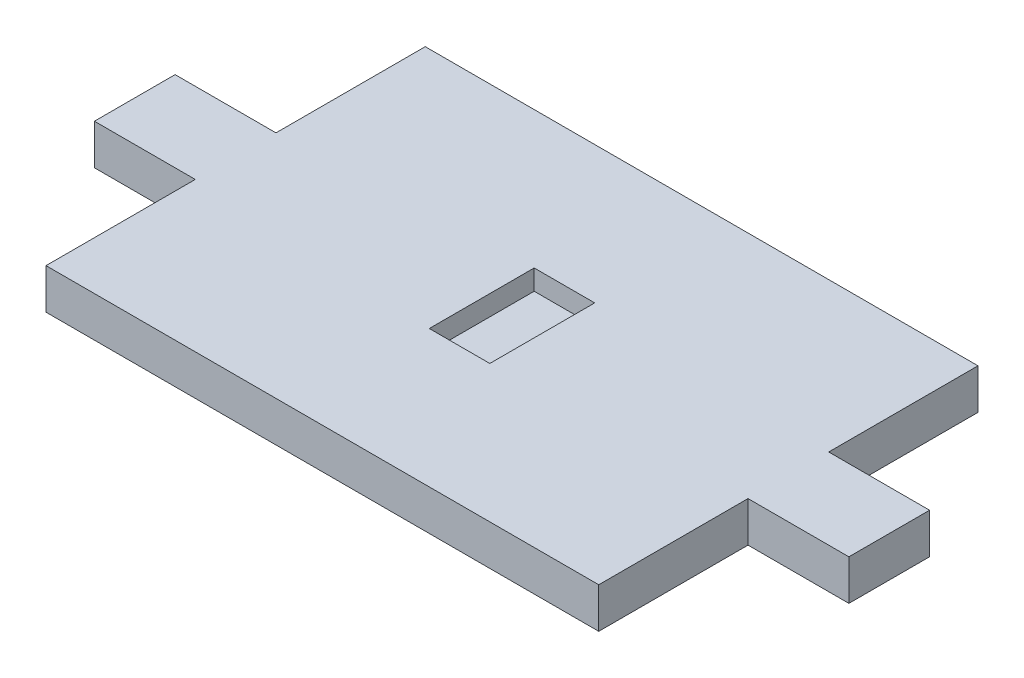
from build123d import *

# Parameters (mm, degrees)
SALIENTE_EXTRUIR1_DEPTH = 10
CROQUIS3_W              = 15
CROQUIS3_H              = 26
CORTAR_EXTRUIR3_DEPTH   = 5


with BuildPart() as part:
    # Croquis1 → Saliente-Extruir1 (new body)
    with BuildSketch(Plane(origin=(0, 0, 0), x_dir=(1, 0, 0), z_dir=(0, 1, 0))):
        Polygon((93.5, -10), (68.5, -10), (68.5, -47), (-68.5, -47), (-68.5, -10), (-93.5, -10), (-93.5, 10), (-68.5, 10), (-68.5, 47), (68.5, 47), (68.5, 10), (93.5, 10), align=None)
    extrude(amount=SALIENTE_EXTRUIR1_DEPTH)

    # Croquis3 → Cortar-Extruir3 (cut)
    with BuildSketch(Plane(origin=(0, 10, 0), x_dir=(1, 0, 0), z_dir=(0, 1, 0))):
        Rectangle(CROQUIS3_W, CROQUIS3_H)
    extrude(amount=-CORTAR_EXTRUIR3_DEPTH, mode=Mode.SUBTRACT)


solid = part.part
